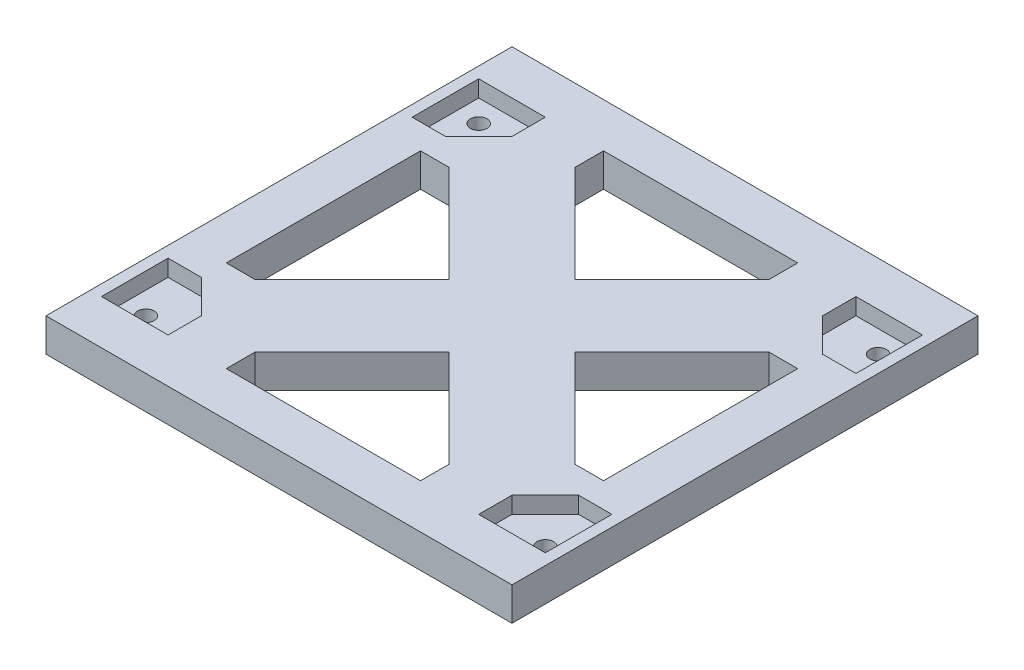
from build123d import *

# Parameters (mm, degrees)
SKETCH1_W                = 84
SKETCH1_H                = 84
BOSS_EXTRUDE1_DEPTH      = 6
SKETCH2_R                = 1.5
CUT_EXTRUDE1_DEPTH       = 119.94536561
CUT_EXTRUDE2_DEPTH       = 119.94536561
CIRPATTERN1_COUNT        = 3
CIRPATTERN1_ANGLE        = 180
CIRPATTERN1_COPY_1_DEPTH = 119.94536561
CIRPATTERN1_COPY_2_DEPTH = 119.94536561
SKETCH4_R                = 1.5
CUT_EXTRUDE4_DEPTH       = 3
MIRROR3_COPY_1_SKETCH_R  = 1.5
MIRROR3_COPY_1_DEPTH     = 3


with BuildPart() as part:
    # Sketch1 → Boss-Extrude1 (new body)
    with BuildSketch(Plane(origin=(0, 0, 0), x_dir=(1, 0, 0), z_dir=(0, 1, 0))):
        with Locations((42, 42)):
            Rectangle(SKETCH1_W, SKETCH1_H)
    extrude(amount=BOSS_EXTRUDE1_DEPTH)

    # Sketch2 → Cut-Extrude1 (cut, through all)
    with BuildSketch(Plane(origin=(0, 6, 0), x_dir=(1, 0, 0), z_dir=(0, 1, 0))):
        with Locations(Location((6, 72, 0), (0, 0, 270))):
            Circle(SKETCH2_R)
        with Locations(Location((6, 12, 0), (0, 0, 270))):
            Circle(SKETCH2_R)
        with Locations(Location((78, 12, 0), (0, 0, 270))):
            Circle(SKETCH2_R)
        with Locations(Location((78, 72, 0), (0, 0, 270))):
            Circle(SKETCH2_R)
    extrude(amount=-CUT_EXTRUDE1_DEPTH, mode=Mode.SUBTRACT)

    # Sketch3 → Cut-Extrude2 (cut, through all)
    with BuildSketch(Plane(origin=(0, 6, 0), x_dir=(1, 0, 0), z_dir=(0, 1, 0))):
        Polygon((24.5, 76), (59.5, 76), (59.5, 70.813708499), (42, 53.313708499), (24.5, 70.813708499), align=None)
    cut_extrude2 = extrude(amount=-CUT_EXTRUDE2_DEPTH, mode=Mode.SUBTRACT)

    # Mirror1: Cut-Extrude2 across plane
    add(cut_extrude2.mirror(Plane.XY.offset(-42)), mode=Mode.SUBTRACT)

    # CirPattern1: Cut-Extrude2 ×3 about axis
    cirpattern1_axis = Axis((42, 0, -42), (0, 1, 0))
    for i in range(1, CIRPATTERN1_COUNT):
        add(cut_extrude2.rotate(cirpattern1_axis, i * CIRPATTERN1_ANGLE / (CIRPATTERN1_COUNT - 1)), mode=Mode.SUBTRACT)

    # CirPattern1 copy 1 sketch → CirPattern1 copy 1 (cut, through all)
    with BuildSketch(Plane(origin=(0, 6, 0), x_dir=(0, 0, -1), z_dir=(0, 1, 0))):
        Polygon((24.5, -76), (59.5, -76), (59.5, -70.813708499), (42, -53.313708499), (24.5, -70.813708499), align=None)
    extrude(amount=-CIRPATTERN1_COPY_1_DEPTH, mode=Mode.SUBTRACT)

    # CirPattern1 copy 2 sketch → CirPattern1 copy 2 (cut, through all)
    with BuildSketch(Plane(origin=(84, 6, 0), x_dir=(-1, 0, 0), z_dir=(0, 1, 0))):
        Polygon((24.5, -76), (59.5, -76), (59.5, -70.813708499), (42, -53.313708499), (24.5, -70.813708499), align=None)
    extrude(amount=-CIRPATTERN1_COPY_2_DEPTH, mode=Mode.SUBTRACT)

    # Sketch4 → Cut-Extrude4 (cut)
    with BuildSketch(Plane(origin=(0, 6, 0), x_dir=(1, 0, 0), z_dir=(0, 1, 0))):
        Polygon((14, 14), (14, 8), (2, 8), (2, 20), (8, 20), align=None)
        with Locations(Location((6, 12, 0), (0, 0, 270))):
            Circle(SKETCH4_R, mode=Mode.SUBTRACT)
    cut_extrude4 = extrude(amount=-CUT_EXTRUDE4_DEPTH, mode=Mode.SUBTRACT)

    # Mirror2: Cut-Extrude4 across plane
    add(cut_extrude4.mirror(Plane.XY.offset(-42)), mode=Mode.SUBTRACT)

    # Mirror3: Cut-Extrude4 across plane
    add(cut_extrude4.mirror(Plane.ZY.offset(-42)), mode=Mode.SUBTRACT)

    # Mirror3 copy 1 sketch → Mirror3 copy 1 (cut)
    with BuildSketch(Plane(origin=(84, 6, -84), x_dir=(-1, 0, 0), z_dir=(0, 1, 0))):
        Polygon((14, 14), (14, 8), (2, 8), (2, 20), (8, 20), align=None)
        with Locations(Location((6, 12, 0), (0, 0, 270))):
            Circle(MIRROR3_COPY_1_SKETCH_R, mode=Mode.SUBTRACT)
    extrude(amount=-MIRROR3_COPY_1_DEPTH, mode=Mode.SUBTRACT)


solid = part.part
